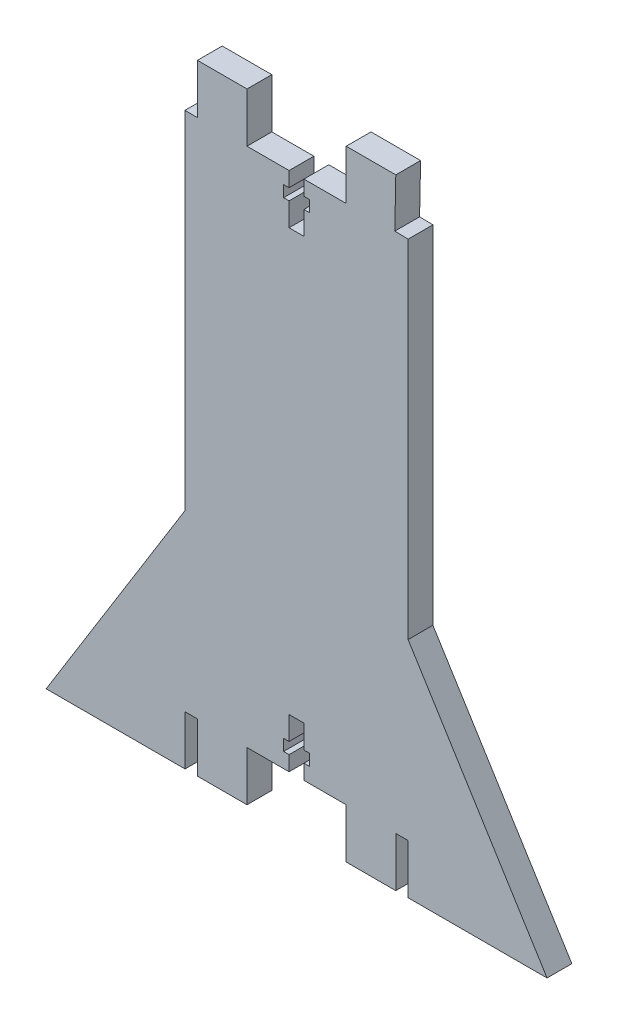
from build123d import *

# Parameters (mm, degrees)
BOSS_EXTRUDE1_DEPTH = 5


with BuildPart() as part:
    # Sketch1 → Boss-Extrude1 (new body)
    with BuildSketch(Plane.XY):
        Polygon((-32.5, -51.191512275), (-30, -51.191512275), (-30, -61.191512275), (-20, -61.191512275), (-20, -51.191512275), (-11.518889855, -51.191512275), (-11.518889855, -48.191512275), (-12.618889855, -48.191512275), (-12.618889855, -45.891512275), (-11.518889855, -45.891512275), (-11.518889855, -41.191512275), (-8.518889855, -41.191512275), (-8.518889855, -45.891512275), (-7.418889855, -45.891512275), (-7.418889855, -48.191512275), (-8.518889855, -48.191512275), (-8.518889855, -51.191512275), (0, -51.191512275), (0, -61.191512275), (10, -61.191512275), (10, -51.191512275), (12.5, -51.191512275), (12.5, -61.191512275), (40.5, -61.191512275), (12.481110145, -16.103821473), (12.481110145, 53.822815833), (9.798922327, 53.87712136), (10, 63.808487725), (0, 63.808487725), (0, 53.808487725), (-8.518889855, 53.808487725), (-8.518889855, 50.808487725), (-7.418889855, 50.808487725), (-7.418889855, 48.508487725), (-8.518889855, 48.508487725), (-8.518889855, 43.808487725), (-11.518889855, 43.808487725), (-11.518889855, 48.508487725), (-12.618889855, 48.508487725), (-12.618889855, 50.808487725), (-11.518889855, 50.808487725), (-11.518889855, 53.808487725), (-20, 53.808487725), (-20, 63.808487725), (-30, 63.808487725), (-30, 53.808487725), (-32.518889855, 53.808487725), (-32.518889855, -16.103821473), (-60.5, -61.191512275), (-32.5, -61.191512275), align=None)
    extrude(amount=BOSS_EXTRUDE1_DEPTH)


solid = part.part
